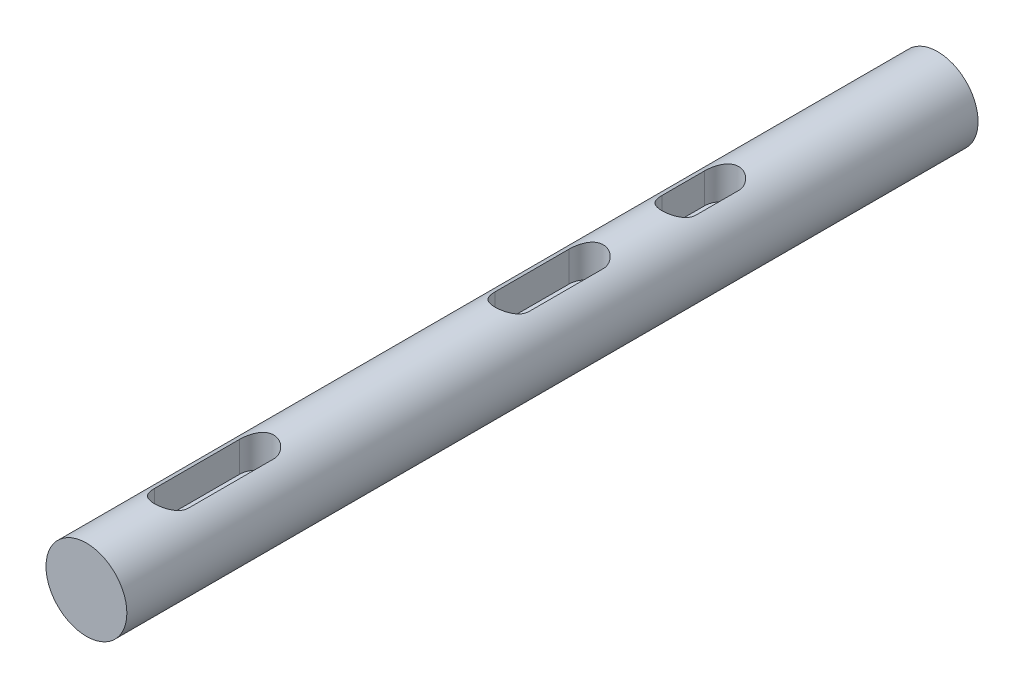
from build123d import *

# Parameters (mm, degrees)
SKETCH1_R           = 4.75
BOSS_EXTRUDE1_DEPTH = 0.0001
BOSS_EXTRUDE2_START = 105
SKETCH4_R           = 4.75
BOSS_EXTRUDE2_DEPTH = 105
CUT_EXTRUDE3_DEPTH  = 4
SKETCH6_R           = 4.75
CUT_EXTRUDE4_DEPTH  = 5


with BuildPart() as part:
    # Sketch1 → Boss-Extrude1 (new body)
    with BuildSketch(Plane.XY):
        Circle(SKETCH1_R)
    extrude(amount=BOSS_EXTRUDE1_DEPTH)

    # Sketch4 → Boss-Extrude2 (add)
    with BuildSketch(Plane(origin=(0, 0, 0), x_dir=(-1, 0, 0), z_dir=(0, 0, -1)).offset(BOSS_EXTRUDE2_START)):
        Circle(SKETCH4_R)
    extrude(amount=-BOSS_EXTRUDE2_DEPTH)

    # Sketch5 → Cut-Extrude3 (cut)
    with BuildSketch(Plane(origin=(0, 4.75, 0), x_dir=(1, 0, 0), z_dir=(0, 1, 0))):
        with BuildLine():
            Line((-2, 10), (-2, 20))
            ThreePointArc((-2, 20), (0, 22), (2, 20))
            Line((2, 20), (2, 10))
            ThreePointArc((2, 10), (0, 8), (-2, 10))
        make_face()
        with BuildLine():
            Line((-2, 50), (-2, 58.71))
            ThreePointArc((-2, 58.71), (0, 60.71), (2, 58.71))
            Line((2, 58.71), (2, 50))
            ThreePointArc((2, 50), (0, 48), (-2, 50))
        make_face()
        with BuildLine():
            Line((-2, 69.62), (-2, 74.62))
            ThreePointArc((-2, 74.62), (0, 76.62), (2, 74.62))
            Line((2, 74.62), (2, 69.62))
            ThreePointArc((2, 69.62), (0, 67.62), (-2, 69.62))
        make_face()
    extrude(amount=-CUT_EXTRUDE3_DEPTH, mode=Mode.SUBTRACT)

    # Sketch6 → Cut-Extrude4 (cut)
    with BuildSketch(Plane(origin=(0, 0, -105), x_dir=(-1, 0, 0), z_dir=(0, 0, -1))):
        Circle(SKETCH6_R)
    extrude(amount=-CUT_EXTRUDE4_DEPTH, mode=Mode.SUBTRACT)


solid = part.part
